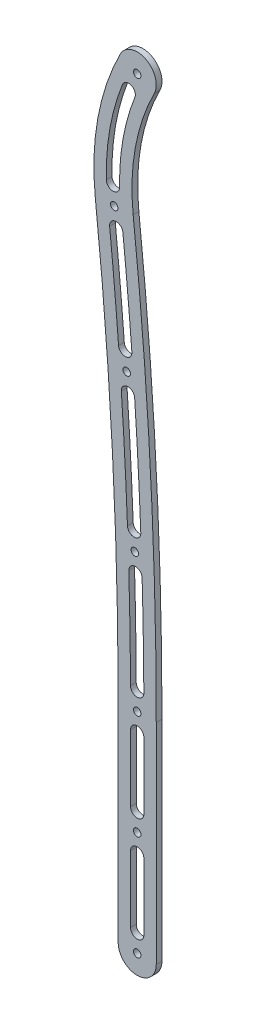
from build123d import *

# Parameters (mm, degrees)
SKETCH_1_R          = 1.95
EXTRUDE_2_DEPTH     = 3
SKETCH_3_R          = 1.95
CUT_EXTRUDE_1_DEPTH = 411.642233029
CUT_EXTRUDE_2_DEPTH = 411.642233029


with BuildPart() as part:
    # 草图1 → 凸台-拉伸2 (new body)
    with BuildSketch(Plane.XY):
        with BuildLine():
            Line((-10, -290), (-10, -400))
            ThreePointArc((-10, -400), (0, -410), (10, -400))
            Line((10, -400), (10, -290))
            ThreePointArc((10, -290), (6.964883906, -177.395762041), (-2.13165062, -65.118518595))
            ThreePointArc((-2.13165062, -65.118518595), (-1.001742213, -34.015540789), (8.921943266, -4.516517282))
            ThreePointArc((8.921943266, -4.516517282), (4.516517282, 8.921943266), (-8.921943266, 4.516517282))
            ThreePointArc((-8.921943266, 4.516517282), (-20.677134638, -30.426817765), (-22.015577858, -67.27013138))
            ThreePointArc((-22.015577858, -67.27013138), (-13.006076822, -178.473132736), (-10, -290))
        make_face()
        Circle(SKETCH_1_R, mode=Mode.SUBTRACT)
        with Locations((0, -400)):
            Circle(SKETCH_1_R, mode=Mode.SUBTRACT)
    extrude(amount=EXTRUDE_2_DEPTH)

    # 草图3 → 切除-拉伸1 (cut, through all)
    with BuildSketch(Plane.XY.offset(3)):
        with Locations((-12.073614239, -66.194324988)):
            Circle(SKETCH_3_R)
        with Locations((0, -290)):
            Circle(SKETCH_3_R)
        with Locations((0, -345)):
            Circle(SKETCH_3_R)
        with Locations((-5.546108146, -138.194324988)):
            Circle(SKETCH_3_R)
        with Locations((-1.246315893, -218)):
            Circle(SKETCH_3_R)
    extrude(amount=-CUT_EXTRUDE_1_DEPTH, mode=Mode.SUBTRACT)

    # 草图4 → 切除-拉伸2 (cut, through all)
    with BuildSketch(Plane.XY.offset(3)):
        with BuildLine():
            Line((3.5, -300), (3.5, -335))
            ThreePointArc((3.5, -335), (0, -338.5), (-3.5, -335))
            Line((-3.5, -335), (-3.5, -300))
            ThreePointArc((-3.5, -300), (0, -296.5), (3.5, -300))
        make_face()
        with BuildLine():
            Line((3.5, -355), (3.5, -390))
            ThreePointArc((3.5, -390), (0, -393.5), (-3.5, -390))
            Line((-3.5, -390), (-3.5, -355))
            ThreePointArc((-3.5, -355), (0, -351.5), (3.5, -355))
        make_face()
        with BuildLine():
            ThreePointArc((-7.748753127, -8.714910959), (-14.36874553, -32.070657967), (-16.228058971, -56.275165217))
            ThreePointArc((-16.228058971, -56.275165217), (-12.648152458, -59.693391271), (-9.229926404, -56.113484758))
            ThreePointArc((-9.229926404, -56.113484758), (-7.477411831, -33.29928315), (-1.237671449, -11.285089041))
            ThreePointArc((-1.237671449, -11.285089041), (-3.208123247, -6.744459161), (-7.748753127, -8.714910959))
        make_face()
        with BuildLine():
            ThreePointArc((-2.812608819, -127.922101985), (-5.01013796, -101.863544894), (-7.534506265, -75.83461682))
            ThreePointArc((-7.534506265, -75.83461682), (-11.375681082, -72.712858338), (-14.497439565, -76.554033155))
            ThreePointArc((-14.497439565, -76.554033155), (-11.981551023, -102.495525828), (-9.79140374, -128.46654799))
            ThreePointArc((-9.79140374, -128.46654799), (-6.029783277, -131.683722448), (-2.812608819, -127.922101985))
        make_face()
        with BuildLine():
            ThreePointArc((1.880579751, -207.862042625), (0.482482294, -177.897281403), (-1.346806184, -147.955750125))
            ThreePointArc((-1.346806184, -147.955750125), (-5.077240441, -144.702465593), (-8.330524974, -148.43289985))
            ThreePointArc((-8.330524974, -148.43289985), (-6.507381374, -178.273852657), (-5.113980353, -208.137957375))
            ThreePointArc((-5.113980353, -208.137957375), (-1.478742925, -211.497280052), (1.880579751, -207.862042625))
        make_face()
        with BuildLine():
            ThreePointArc((3.475925039, -279.98317593), (3.187918187, -253.936615897), (2.574358276, -227.895690765))
            ThreePointArc((2.574358276, -227.895690765), (-1.028396268, -224.501554691), (-4.422532343, -228.104309235))
            ThreePointArc((-4.422532343, -228.104309235), (-3.81103348, -254.057758666), (-3.523994089, -280.01682407))
            ThreePointArc((-3.523994089, -280.01682407), (-0.007210455, -283.499959564), (3.475925039, -279.98317593))
        make_face()
    extrude(amount=-CUT_EXTRUDE_2_DEPTH, mode=Mode.SUBTRACT)


solid = part.part
